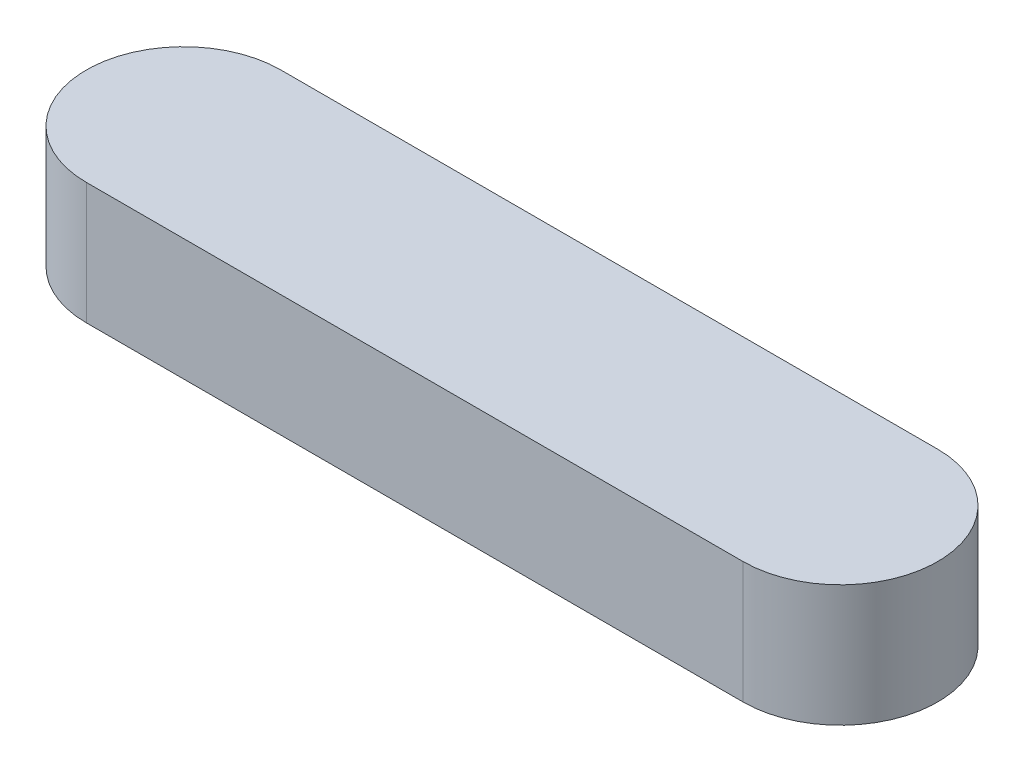
from build123d import *

# Parameters (mm, degrees)
BODY_DEPTH = 10


with BuildPart() as part:
    # Sketch4 → body (new body)
    with BuildSketch(Plane(origin=(0, 0, 0), x_dir=(1, 0, 0), z_dir=(0, 1, 0))):
        with BuildLine():
            Line((27, 8), (-27, 8))
            ThreePointArc((-27, 8), (-35, 0), (-27, -8))
            Line((-27, -8), (27, -8))
            ThreePointArc((27, -8), (35, 0), (27, 8))
        make_face()
    extrude(amount=BODY_DEPTH)


solid = part.part
